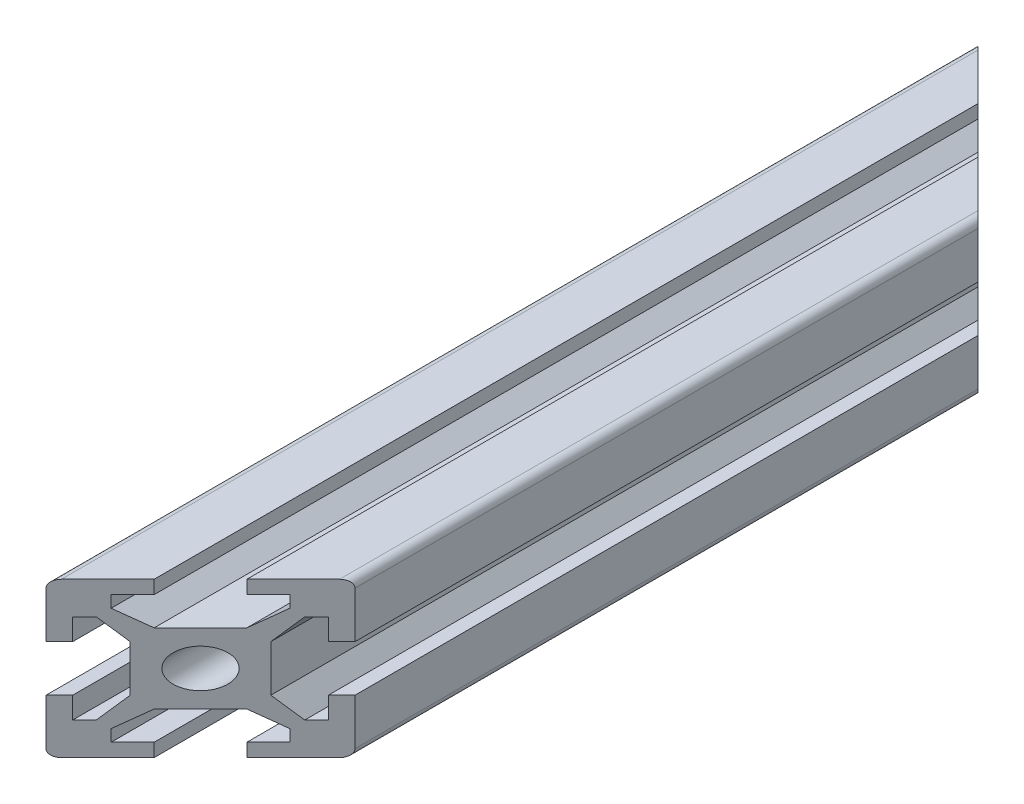
from build123d import *

# Parameters (mm, degrees)
BOSS_EXTRUDE1_DEPTH     = 60.325
CUT_EXTRUDE1_DEPTH      = 122.476016151
CUT_EXTRUDE1_DEPTH_BACK = 122.476016151
SKETCH2_R               = 2.5
FILLET1_R               = 1
SKETCH3_W               = 42.278906
SKETCH3_H               = 22
CUT_EXTRUDE2_DEPTH      = 93.975878928
SKETCH4_W               = 35
SKETCH4_H               = 22.104489803
CUT_EXTRUDE3_DEPTH      = 93.975878928


with BuildPart() as part:
    # Sketch1 → Boss-Extrude1 (new, symmetric)
    with BuildSketch(Plane.XY):
        Polygon((-10, 10), (-3, 10), (-3, 8.272610059), (-5.783778863, 8.272610059), (-5.783778863, 6.747994248), (-3, 4.550753814), (3, 4.550753814), (5.783778863, 6.747994248), (5.783778863, 8.272610059), (3, 8.272610059), (3, 10), (10, 10), (10, 3), (8.272610059, 3), (8.272610059, 5.783778863), (6.747994248, 5.783778863), (4.55, 3.000595152), (4.55, -2.999404848), (6.747994248, -5.783778863), (8.272610059, -5.783778863), (8.272610059, -3), (10, -3), (10, -10), (3, -10), (3, -8.272610059), (5.783778863, -8.272610059), (5.783778863, -6.747994248), (2.999404848, -4.55), (-3.000595152, -4.55), (-5.783778863, -6.747994248), (-5.783778863, -8.272610059), (-3, -8.272610059), (-3, -10), (-10, -10), (-10, -3), (-8.272610059, -3), (-8.272610059, -5.783778863), (-6.747994248, -5.783778863), (-4.55, -3.000595152), (-4.55, 2.999404848), (-6.747994248, 5.783778863), (-8.272610059, 5.783778863), (-8.272610059, 3), (-10, 3), align=None)
    extrude(amount=BOSS_EXTRUDE1_DEPTH, both=True)

    # Sketch2 → Cut-Extrude1 (cut, two sides: drawn at the far end of the back side and taken through both)
    with BuildSketch(Plane.XY.offset(60.325).offset(-CUT_EXTRUDE1_DEPTH_BACK)):
        Circle(SKETCH2_R)
    extrude(amount=CUT_EXTRUDE1_DEPTH + CUT_EXTRUDE1_DEPTH_BACK, mode=Mode.SUBTRACT)

    # Fillet1
    fillet1_edges = [part.edges().sort_by_distance(p)[0] for p in [
        (-10, 10, 0),
        (10, 10, 0),
        (10, -10, 0),
        (-10, -10, 0),
    ]]
    fillet(fillet1_edges, radius=FILLET1_R)

    # Sketch3 → Cut-Extrude2 (cut, through all)
    with BuildSketch(Plane(origin=(25.1625, 0, -25.1625), x_dir=(0.7071067811865477, 0, 0.7071067811865475), z_dir=(-0.7071067811865475, 0, 0.7071067811865477))):
        with Locations((-33.751267597, 0.067646977)):
            Rectangle(SKETCH3_W, SKETCH3_H)
    extrude(amount=-CUT_EXTRUDE2_DEPTH, mode=Mode.SUBTRACT)

    # Sketch4 → Cut-Extrude3 (cut, through all)
    with BuildSketch(Plane(origin=(25.1625, 0, 25.1625), x_dir=(-0.7071067811865477, 0, 0.7071067811865475), z_dir=(-0.7071067811865475, 0, -0.7071067811865477))):
        with Locations((37.116393961, 0.016996688)):
            Rectangle(SKETCH4_W, SKETCH4_H)
    extrude(amount=-CUT_EXTRUDE3_DEPTH, mode=Mode.SUBTRACT)


solid = part.part
